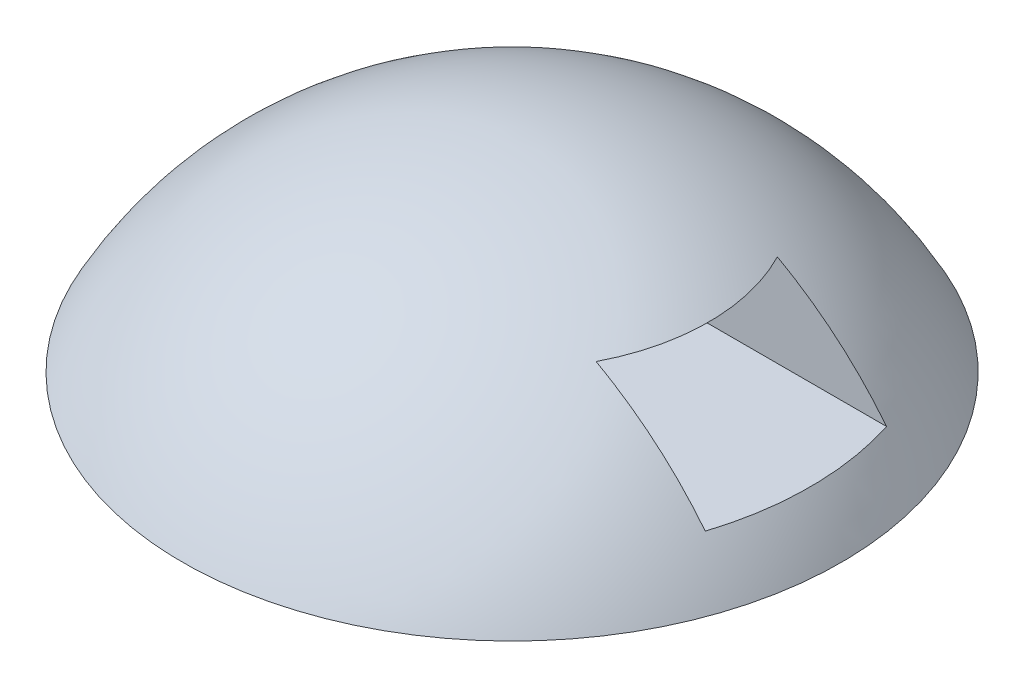
from build123d import *

# Parameters (mm, degrees)
CUT_EXTRUDE1_DEPTH       = 16.362291496
CUT_EXTRUDE1_DEPTH_BACK  = 5
SKETCH2_W                = 5.5
SKETCH2_H                = 2.8
M3_CLEARANCE_HOLE1_D     = 3.2
M3_CLEARANCE_HOLE1_DEPTH = 1.5
BOSS_EXTRUDE1_DEPTH      = 4.3


with BuildPart() as part:
    # Sketch1 → Revolve1 (revolve)
    with BuildSketch(Plane(origin=(0, 0, 0), x_dir=(0, 0, -1), z_dir=(1, 0, 0))):
        with BuildLine():
            Line((0, 0), (0, 6))
            ThreePointArc((0, 6), (5.830951895, 4.384919825), (10, 0))
            Line((10, 0), (0, 0))
        make_face()
    revolve(axis=Axis((0, 0, 0), (0, 1, 0)))

    # Sketch2 → Cut-Extrude1 (cut, two sides: drawn at the far end of the back side and taken through both)
    with BuildSketch(Plane(origin=(0, 0, 0), x_dir=(0, 0, -1), z_dir=(1, 0, 0)).offset(-CUT_EXTRUDE1_DEPTH_BACK)):
        with Locations((0, 2.9)):
            Rectangle(SKETCH2_W, SKETCH2_H)
    extrude(amount=CUT_EXTRUDE1_DEPTH + CUT_EXTRUDE1_DEPTH_BACK, mode=Mode.SUBTRACT)

    # M3 Clearance Hole1
    with Locations(Plane(origin=(0, 0, 0), x_dir=(-1, 0, 0), z_dir=(0, -1, 0))):
        with Locations((0, 0)):
            Hole(M3_CLEARANCE_HOLE1_D / 2, depth=M3_CLEARANCE_HOLE1_DEPTH)

    # Sketch11 → Boss-Extrude1 (add)
    with BuildSketch(Plane(origin=(0, 0, 0), x_dir=(1, 0, 0), z_dir=(0, 1, 0))):
        with BuildLine():
            Line((5.29913515, 2.75), (-1.703183294, 2.95))
            Line((-1.703183294, 2.95), (-3.406366588, 0))
            Line((-3.406366588, 0), (-1.703183294, -2.95))
            Line((-1.703183294, -2.95), (5.29913515, -2.75))
            ThreePointArc((5.29913515, -2.75), (-5.970203793, 0), (5.29913515, 2.75))
        make_face()
    extrude(amount=BOSS_EXTRUDE1_DEPTH)


solid = part.part
